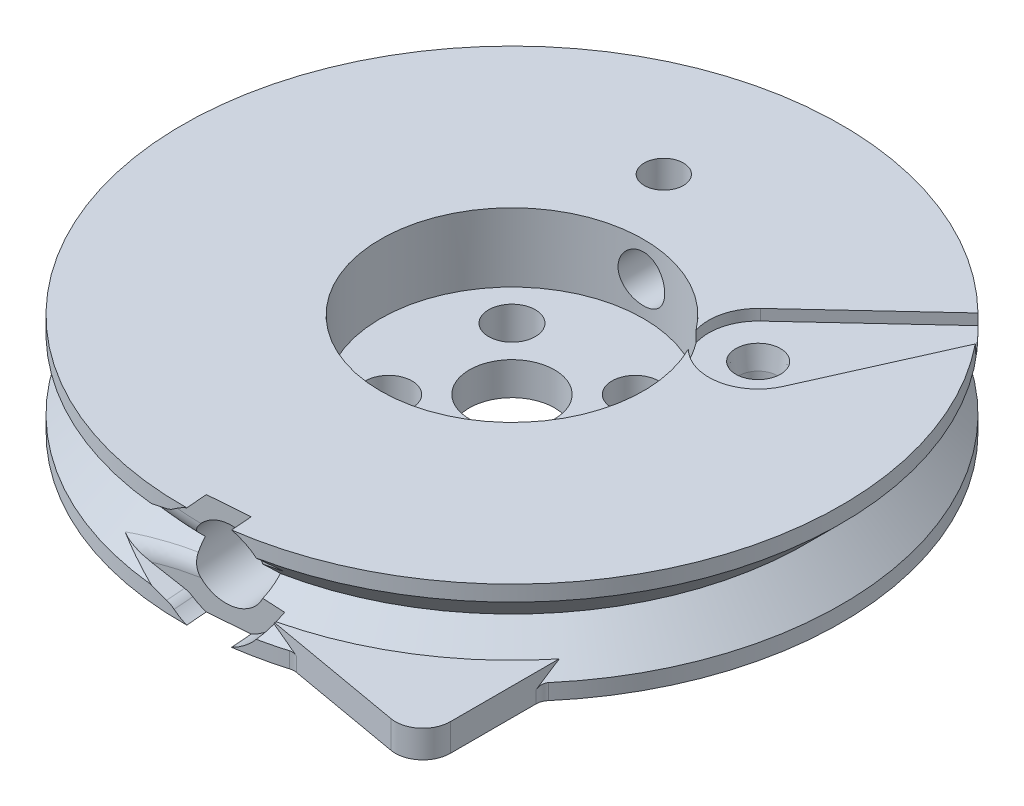
from build123d import *

# Parameters (mm, degrees)
SKETCH5_R                     = 18.25
BOSS_EXTRUDE1_DEPTH           = 2.7
FILLET1_R                     = 1.4
CUT_EXTRUDE1_DEPTH            = 3.5
SKETCH8_R                     = 1.4
CUT_EXTRUDE2_DEPTH            = 35.576870882
SKETCH9_R                     = 4.5
SLEEVE_BEARING_BORE_DEPTH     = 36.412003615
SCREW_HEAD_POCKET_DEPTH       = 36.412003615
SKETCH15_R                    = 4
WIRE_ROPE_CINCH_DEPTH         = 1.6
SKETCH16_R                    = 2.55
HEAT_SET_INSERT_HOLE_DEPTH    = 7
LIMIT_SWITCH_SLOT_DEPTH       = 36.412003779
LIMIT_START                   = -5.8
LIMIT_SWITCH_POCKET_DEPTH     = 5.8
SKETCH35_R                    = 1
LIMIT_SWITCH_HOLES_DEPTH      = 35.433123744
SKETCH19_R                    = 3.1
CUT_EXTRUDE9_DEPTH            = 7.4
HOME_SWITCH_TAB_DEPTH         = 2
SKETCH17_R                    = 4
CUT_EXTRUDE7_DEPTH            = 1.6
SKETCH18_R                    = 2.55
CUT_EXTRUDE8_DEPTH            = 7
SKETCH21_R                    = 9.575
CUT_EXTRUDE13_DEPTH           = 5
SKETCH24_W                    = 1.7
SKETCH24_H                    = 17.7
M3_CLEARANCE_HOLE1_AT_2_COUNT = 2
M3_CLEARANCE_HOLE1_AT_2_PITCH = 8.980256121
M3_CLEARANCE_HOLE1_AT_3_COUNT = 2
M3_CLEARANCE_HOLE1_AT_3_PITCH = 12.7
M3_CLEARANCE_HOLE1_AT_4_COUNT = 2
M3_CLEARANCE_HOLE1_AT_4_PITCH = 8.980256121
SET_SCREW_HOLE_REACH          = 57.415
SET_SCREW_HOLE_END_RADIUS     = 9.575
SKETCH25_R                    = 1.7
CUT_EXTRUDE15_DEPTH           = 0.8
SKETCH27_R                    = 1.4
CUT_EXTRUDE16_DEPTH           = 37.30359691
FILLET3_R                     = 1
CUT_EXTRUDE21_DEPTH           = 54.980696213
FILLET5_R                     = 1.6
SKETCH40_R                    = 1.425
CUT_EXTRUDE19_DEPTH           = 37.067036937
CHAMFER1_SIZE                 = 4
CHAMFER1_SIZE2                = 0.349954654
CHAMFER3_SIZE                 = 1.6
CHAMFER3_SIZE2                = 0.224865336
FILLET8_R                     = 2


with BuildPart() as part:
    # Sketch4 → Revolve1 (revolve)
    with BuildSketch(Plane(origin=(0, 0, 0), x_dir=(0, 0, -1), z_dir=(1, 0, 0))):
        Polygon((0, 0), (-24, 0), (-24, 1.138733992), (-21.438733992, 3.7), (-24, 6.261266008), (-24, 7.4), (0, 7.4), align=None)
    revolve(axis=Axis((0, 7.4, 0), (0, -1, 0)))

    # Sketch5 → Boss-Extrude1 (add)
    with BuildSketch(Plane.XZ):
        with Locations(Location((0, 0, 0), (0, 0, 270))):
            Circle(SKETCH5_R)
    extrude(amount=BOSS_EXTRUDE1_DEPTH)

    # Fillet1
    fillet1_edges = [part.edges().sort_by_distance(p)[0] for p in [
        (0, 0, 18.25),
    ]]
    fillet(fillet1_edges, radius=FILLET1_R)

    # Sketch7 → Cut-Extrude1 (cut)
    with BuildSketch(Plane.XZ.offset(2.7)):
        with BuildLine():
            Line((-14.273064383, -14.721842042), (-8.634125379, -9.480067375))
            ThreePointArc((-8.634125379, -9.480067375), (-8.991329737, -3.914860926), (-14.37293646, -5.376855059))
            Line((-14.37293646, -5.376855059), (-21.564176599, -21.4994233))
            Line((-21.564176599, -21.4994233), (-14.273064383, -14.721842042))
        make_face()
    extrude(amount=-CUT_EXTRUDE1_DEPTH, mode=Mode.SUBTRACT)

    # Sketch8 → Cut-Extrude2 (cut, through all)
    with BuildSketch(Plane.XZ.offset(-0.8)):
        with Locations(Location((-11.085159379, -6.843320833, 0), (0, 0, 270))):
            Circle(SKETCH8_R)
    extrude(amount=-CUT_EXTRUDE2_DEPTH, mode=Mode.SUBTRACT)

    # Sketch9 → sleeve bearing bore (cut, through all)
    with BuildSketch(Plane.XZ.offset(2.7)):
        with Locations(Location((0, 0, 0), (0, 0, 270))):
            Circle(SKETCH9_R)
    extrude(amount=-SLEEVE_BEARING_BORE_DEPTH, mode=Mode.SUBTRACT)

    # Sketch11 → screw head pocket (cut, through all)
    with BuildSketch(Plane.XZ.offset(2.7)):
        with BuildLine():
            ThreePointArc((13.637902876, -8.41923347), (15.058344169, -5.488365693), (15.856954091, -2.330856931))
            ThreePointArc((15.856954091, -2.330856931), (13.325138395, 1.073538652), (9.920742813, -1.458277044))
            ThreePointArc((9.920742813, -1.458277044), (9.421100599, -3.433740439), (8.532415883, -5.267408196))
            ThreePointArc((8.532415883, -5.267408196), (9.509246742, -9.396064329), (13.637902876, -8.41923347))
        make_face()
    extrude(amount=-SCREW_HEAD_POCKET_DEPTH, mode=Mode.SUBTRACT)

    # Sketch15 → Wire Rope Cinch (cut)
    with BuildSketch(Plane(origin=(-1.830283843, 0, 23.930107836), x_dir=(0.9970878265112338, 0, 0.07626182677528456), z_dir=(-0.07626182677528456, 0, 0.997087826511234))):
        with Locations((0, 3.7)):
            Circle(SKETCH15_R)
    extrude(amount=-WIRE_ROPE_CINCH_DEPTH, mode=Mode.SUBTRACT)

    # Sketch16 → Heat Set Insert Hole (cut)
    with BuildSketch(Plane(origin=(-1.70826492, 0, 22.334767314), x_dir=(0.9970878265112338, 0, 0.07626182677528458), z_dir=(-0.07626182677528458, 0, 0.997087826511234))):
        with Locations((0, 3.7)):
            Circle(SKETCH16_R)
    extrude(amount=-HEAT_SET_INSERT_HOLE_DEPTH, mode=Mode.SUBTRACT)

    # Sketch33 → Limit Switch Slot (cut, through all)
    with BuildSketch(Plane.XZ.offset(2.7)):
        with BuildLine():
            ThreePointArc((-2.879883094, -12.369166236), (-1.449411744, -12.617020472), (0, -12.7))
            ThreePointArc((0, -12.7), (2.1, -14.8), (0, -16.9))
            ThreePointArc((0, -16.9), (-1.928744762, -16.789578424), (-3.832285377, -16.459756644))
            ThreePointArc((-3.832285377, -16.459756644), (-5.40137944, -13.938260298), (-2.879883094, -12.369166236))
        make_face()
    extrude(amount=-LIMIT_SWITCH_SLOT_DEPTH, mode=Mode.SUBTRACT)

    # Sketch34 → Limit Switch Pocket (cut)
    with BuildSketch(Plane(origin=(0, 7.4, 0), x_dir=(1, 0, 0), z_dir=(0, 1, 0)).offset(LIMIT_START)):
        with BuildLine():
            Line((0, 6.5), (0, 12.7))
            ThreePointArc((0, 12.7), (-1.449411744, 12.617020472), (-2.879883094, 12.369166236))
            ThreePointArc((-2.879883094, 12.369166236), (-5.40137944, 13.938260298), (-3.832285377, 16.459756644))
            ThreePointArc((-3.832285377, 16.459756644), (-1.928744762, 16.789578424), (0, 16.9))
            Line((0, 16.9), (0, 19.2))
            Line((0, 19.2), (7.184010022, 19.2))
            ThreePointArc((7.184010022, 19.2), (19.294966587, 6.924901761), (17.753520778, -10.25))
            Line((17.753520778, -10.25), (5.629165125, -3.25))
            ThreePointArc((5.629165125, -3.25), (5.629165125, 3.25), (0, 6.5))
        make_face()
    extrude(amount=LIMIT_SWITCH_POCKET_DEPTH, mode=Mode.SUBTRACT)

    # Sketch35 → Limit Switch Holes (cut, through all)
    with BuildSketch(Plane(origin=(0, 1.6, 0), x_dir=(1, 0, 0), z_dir=(0, 1, 0))):
        with Locations(Location((5, 16.1, 0), (0, 0, 270))):
            Circle(SKETCH35_R)
    extrude(amount=-LIMIT_SWITCH_HOLES_DEPTH, mode=Mode.SUBTRACT)


with BuildPart() as body_2:
    # Sketch13 → Revolve2 (revolve)
    with BuildSketch(Plane(origin=(0, 0, 0), x_dir=(0, 0, -1), z_dir=(1, 0, 0))):
        Polygon((0, -2.9), (0, -10.3), (-24, -10.3), (-24, -9.161266008), (-21.438733992, -6.6), (-24, -4.038733992), (-24, -2.9), align=None)
    revolve(axis=Axis((0, -2.9, 0), (0, -1, 0)))

    # Sketch19 → Cut-Extrude9 (cut)
    with BuildSketch(Plane.XZ.offset(10.3)):
        with Locations(Location((0, 0, 0), (0, 0, 270))):
            Circle(SKETCH19_R)
    extrude(amount=-CUT_EXTRUDE9_DEPTH, mode=Mode.SUBTRACT)

    # Sketch42 → home switch tab (add)
    with BuildSketch(Plane.XZ.offset(10.3)):
        with BuildLine():
            Line((18, 15.874507866), (18, 24.874507866))
            Line((18, 24.874507866), (7.044720563, 22.942796521))
            Line((7.044720563, 22.942796521), (5.075105057, 22.595500165))
            ThreePointArc((5.075105057, 22.595500165), (12.215292402, 19.674855796), (18, 14.570975227))
            Line((18, 14.570975227), (18, 15.874507866))
        make_face()
    extrude(amount=-HOME_SWITCH_TAB_DEPTH)

    # Sketch17 → Cut-Extrude7 (cut)
    with BuildSketch(Plane(origin=(1.830283843, 0, 23.930107836), x_dir=(0.997087826511234, 0, -0.0762618267752854), z_dir=(0.0762618267752854, 0, 0.997087826511234))):
        with Locations((0, -6.6)):
            Circle(SKETCH17_R)
    extrude(amount=-CUT_EXTRUDE7_DEPTH, mode=Mode.SUBTRACT)

    # Sketch18 → Cut-Extrude8 (cut)
    with BuildSketch(Plane(origin=(1.70826492, 0, 22.334767314), x_dir=(0.997087826511234, 0, -0.07626182677528541), z_dir=(0.07626182677528541, 0, 0.997087826511234))):
        with Locations((0, -6.6)):
            Circle(SKETCH18_R)
    extrude(amount=-CUT_EXTRUDE8_DEPTH, mode=Mode.SUBTRACT)

    # Sketch21 → Cut-Extrude13 (cut)
    with BuildSketch(Plane.XZ.offset(2.9)):
        with Locations(Location((0, 0, 0), (0, 0, 270))):
            Circle(SKETCH21_R)
    extrude(amount=CUT_EXTRUDE13_DEPTH, mode=Mode.SUBTRACT)

    # Sketch24 → M3 Clearance Hole1 (revolve, cut)
    with BuildSketch(Plane(origin=(4.490128061, -10.3, -4.490128061), x_dir=(0, 0, -1), z_dir=(1, 0, 0))):
        with Locations((0.85, 8.85)):
            Rectangle(SKETCH24_W, SKETCH24_H)
    m3_clearance_hole1 = revolve(axis=Axis((4.490128061, -16.65, -4.490128061), (0, 1, 0)), mode=Mode.SUBTRACT)

    # M3 Clearance Hole1 at 2: M3 Clearance Hole1 ×2
    with Locations(*[(0, 0, i * M3_CLEARANCE_HOLE1_AT_2_PITCH) for i in range(1, M3_CLEARANCE_HOLE1_AT_2_COUNT)]):
        add(m3_clearance_hole1, mode=Mode.SUBTRACT)

    # M3 Clearance Hole1 at 3: M3 Clearance Hole1 ×2
    with Locations(*[Vector(-0.7071067811865491, 0, 0.707106781186546) * (i * M3_CLEARANCE_HOLE1_AT_3_PITCH) for i in range(1, M3_CLEARANCE_HOLE1_AT_3_COUNT)]):
        add(m3_clearance_hole1, mode=Mode.SUBTRACT)

    # M3 Clearance Hole1 at 4: M3 Clearance Hole1 ×2
    with Locations(*[(-i * M3_CLEARANCE_HOLE1_AT_4_PITCH, 0, 0) for i in range(1, M3_CLEARANCE_HOLE1_AT_4_COUNT)]):
        add(m3_clearance_hole1, mode=Mode.SUBTRACT)

    # Set Screw Hole: up to this cylinder (the profile starts outside it)
    set_screw_hole_end = Plane(origin=(0, -5.4, 0), z_dir=(0, 1, 0)) * Cylinder(SET_SCREW_HOLE_END_RADIUS, 134.98, mode=Mode.PRIVATE)
    # Sketch25 → Set Screw Hole (cut, up to the surface)
    with BuildSketch(Plane(origin=(0, 0, -24), x_dir=(-1, 0, 0), z_dir=(0, 0, -1)), mode=Mode.PRIVATE) as set_screw_hole_sk1:
        with Locations(Location((0, -5.4, 0), (0, 0, 90))):
            Circle(SKETCH25_R)
    set_screw_hole_tool1 = extrude(set_screw_hole_sk1.sketch, amount=-SET_SCREW_HOLE_REACH, mode=Mode.PRIVATE) - set_screw_hole_end
    add(set_screw_hole_tool1.solids().sort_by_distance((0, -5.4, -24))[0], mode=Mode.SUBTRACT)

    # Sketch26 → Cut-Extrude15 (cut)
    with BuildSketch(Plane(origin=(0, -2.9, 0), x_dir=(1, 0, 0), z_dir=(0, 1, 0))):
        with BuildLine():
            Line((14.37293646, 5.376855059), (21.564176599, 21.4994233))
            Line((21.564176599, 21.4994233), (8.634125379, 9.480067375))
            ThreePointArc((8.634125379, 9.480067375), (8.991329737, 3.914860926), (14.37293646, 5.376855059))
        make_face()
    extrude(amount=-CUT_EXTRUDE15_DEPTH, mode=Mode.SUBTRACT)

    # Sketch27 → Cut-Extrude16 (cut, through all)
    with BuildSketch(Plane(origin=(0, -3.7, 0), x_dir=(1, 0, 0), z_dir=(0, 1, 0))):
        with Locations(Location((11.085159379, 6.843320833, 0), (0, 0, 270))):
            Circle(SKETCH27_R)
    extrude(amount=-CUT_EXTRUDE16_DEPTH, mode=Mode.SUBTRACT)

    # Fillet3
    fillet3_edges = [body_2.edges().sort_by_distance(p)[0] for p in [
        (7.044720563, -9.730633004, 22.942796521),
        (18, -9.730633004, 15.874507866),
    ]]
    fillet(fillet3_edges, radius=FILLET3_R)

    # Sketch44 → Cut-Extrude21 (cut, through all)
    with BuildSketch(Plane(origin=(1.70826492, 0, 22.334767314), x_dir=(0.9970878265112338, 0, -0.0762618267752854), z_dir=(0.0762618267752854, 0, 0.9970878265112338))):
        Polygon((-10, -7.6), (-10, -5.6), (0, -2.9), (0, -10.3), align=None)
    extrude(amount=CUT_EXTRUDE21_DEPTH, mode=Mode.SUBTRACT)

    # Fillet5
    fillet5_edges = [body_2.edges().sort_by_distance(p)[0] for p in [
        (-0.897574071, -9.579384958, 23.261761405),
        (-3.484452903, -8.158701879, 22.731930068),
        (-3.484452903, -5.041298121, 22.731930068),
        (-0.897574071, -3.620615042, 23.261761405),
    ]]
    fillet(fillet5_edges, radius=FILLET5_R)

    # Sketch40 → Cut-Extrude19 (cut, through all)
    with BuildSketch(Plane(origin=(0, -2.9, 0), x_dir=(1, 0, 0), z_dir=(0, 1, 0))):
        with Locations(Location((-3.356084236, 14.41446144, 0), (0, 0, 270))):
            Circle(SKETCH40_R)
    extrude(amount=-CUT_EXTRUDE19_DEPTH, mode=Mode.SUBTRACT)

    # Chamfer1
    chamfer1_edges = [body_2.edges().sort_by_distance(p)[0] for p in [
        (-3.356084236, -10.3, -15.83946144),
    ]]
    chamfer1_side = [body_2.faces().sort_by_distance(p)[0] for p in [
        (-3.356084236, -6.6, -15.83946144),
    ]]
    chamfer(chamfer1_edges, length=CHAMFER1_SIZE, length2=CHAMFER1_SIZE2, reference=chamfer1_side[0])

    # Chamfer3
    chamfer3_edges = [body_2.edges().sort_by_distance(p)[0] for p in [
        (11.085159379, -3.7, -8.243320833),
    ]]
    chamfer3_side = [body_2.faces().sort_by_distance(p)[0] for p in [
        (11.085159379, -7, -8.243320833),
    ]]
    chamfer(chamfer3_edges, length=CHAMFER3_SIZE, length2=CHAMFER3_SIZE2, reference=chamfer3_side[0])

    # Fillet8
    fillet8_edges = [body_2.edges().sort_by_distance(p)[0] for p in [
        (18, -9.3, 24.874507866),
    ]]
    fillet(fillet8_edges, radius=FILLET8_R)


solid = body_2.part
